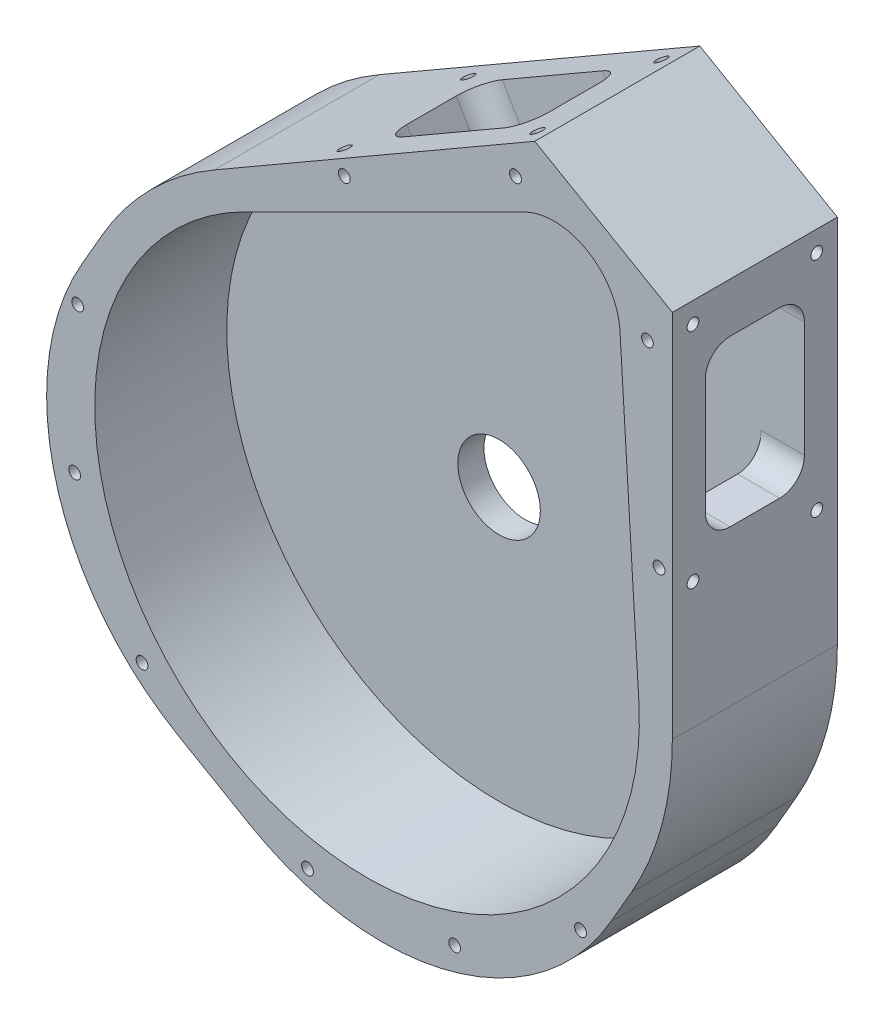
from build123d import *

# Parameters (mm, degrees)
BOSS_EXTRUDE1_DEPTH            = 31.75
CUT_EXTRUDE3_DEPTH             = 25.4
CUT_EXTRUDE4_REACH             = 168.724
F_4_40_TAPPED_HOLE1_AT_2_COUNT = 2
F_4_40_TAPPED_HOLE1_AT_2_PITCH = 23.8125
F_4_40_TAPPED_HOLE1_AT_3_COUNT = 2
F_4_40_TAPPED_HOLE1_AT_3_PITCH = 49.032938546
F_4_40_TAPPED_HOLE1_AT_4_COUNT = 2
F_4_40_TAPPED_HOLE1_AT_4_PITCH = 42.8625
F_4_40_TAPPED_HOLE3_AT_2_COUNT = 2
F_4_40_TAPPED_HOLE3_AT_2_PITCH = 105.48665894
F_4_40_TAPPED_HOLE3_AT_3_COUNT = 2
F_4_40_TAPPED_HOLE3_AT_3_PITCH = 124.969097047
F_4_40_TAPPED_HOLE3_AT_4_COUNT = 2
F_4_40_TAPPED_HOLE3_AT_4_PITCH = 36.810720416
F_4_40_TAPPED_HOLE3_AT_5_COUNT = 2
F_4_40_TAPPED_HOLE3_AT_5_PITCH = 137.285419975
SKETCH23_R                     = 7.9375
CUT_EXTRUDE6_DEPTH             = 123.151190591
SKETCH24_R                     = 10.0076
CUT_EXTRUDE9_DEPTH             = 1.3208
F_2_56_TAPPED_HOLE1_AT_2_COUNT = 2
F_2_56_TAPPED_HOLE1_AT_2_PITCH = 23.23749988
F_2_56_TAPPED_HOLE1_AT_3_COUNT = 2
F_2_56_TAPPED_HOLE1_AT_3_PITCH = 32.862787571
F_2_56_TAPPED_HOLE1_AT_4_COUNT = 2
F_2_56_TAPPED_HOLE1_AT_4_PITCH = 23.2375
LPATTERN1_COUNT                = 2
LPATTERN1_PITCH                = 71.501
F_4_40_TAPPED_HOLE5_AT_2_COUNT = 2
F_4_40_TAPPED_HOLE5_AT_2_PITCH = 12.7
F_4_40_TAPPED_HOLE5_AT_3_COUNT = 2
F_4_40_TAPPED_HOLE5_AT_3_PITCH = 95.193833559
FILLET3_R                      = 50.8


with BuildPart() as part:
    # Sketch1 (on Front Plane) → Boss-Extrude1 (new body)
    with BuildSketch(Plane.XY):
        with BuildLine():
            Line((58.7375, 0), (58.7375, 71.178534783))
            Line((58.7375, 71.178534783), (32.273669326, 86.457434546))
            Line((32.273669326, 86.457434546), (-29.36875, 50.868167155))
            ThreePointArc((-29.36875, 50.868167155), (-41.53368456, 41.53368456), (-50.868167155, 29.36875))
            Line((-50.868167155, 29.36875), (-80.236917155, -21.499417155))
            Line((-80.236917155, -21.499417155), (21.499417155, -80.236917155))
            Line((21.499417155, -80.236917155), (50.868167155, -29.36875))
            ThreePointArc((50.868167155, -29.36875), (56.736068222, -15.202383662), (58.7375, 0))
        make_face()
    extrude(amount=BOSS_EXTRUDE1_DEPTH)

    # Sketch4 → Cut-Extrude3 (cut)
    with BuildSketch(Plane.XY.offset(31.75)):
        with BuildLine():
            Line((30.568366553, 73.812917761), (-23.525977534, 46.807889691))
            ThreePointArc((-23.525977534, 46.807889691), (-26.19375, -45.368905841), (52.299810337, 3.029850652))
            Line((52.299810337, 3.029850652), (48.639678632, 63.379440867))
            ThreePointArc((48.639678632, 63.379440867), (42.332250779, 73.321609148), (30.568366553, 73.812917761))
        make_face()
    extrude(amount=-CUT_EXTRUDE3_DEPTH, mode=Mode.SUBTRACT)

    # Cut-Extrude4: up to this plane
    cut_extrude4_end = Plane(origin=(48.639678632, 63.379440867, -164.95869769), z_dir=(0.9981659181954072, 0.06053758958795559, 0))
    # Sketch5 → Cut-Extrude4 (cut, up to the surface)
    with BuildSketch(Plane(origin=(58.7375, 0, 0), x_dir=(0, 0, -1), z_dir=(1, 0, 0)), mode=Mode.PRIVATE) as cut_extrude4_sk1:
        with BuildLine():
            Line((-20.6375, 29.903534783), (-11.1125, 29.903534783))
            ThreePointArc((-11.1125, 29.903534783), (-7.744903955, 31.298438737), (-6.35, 34.666034783))
            Line((-6.35, 34.666034783), (-6.35, 56.891034783))
            ThreePointArc((-6.35, 56.891034783), (-7.744903955, 60.258630828), (-11.1125, 61.653534783))
            Line((-11.1125, 61.653534783), (-20.6375, 61.653534783))
            ThreePointArc((-20.6375, 61.653534783), (-24.005096045, 60.258630828), (-25.4, 56.891034783))
            Line((-25.4, 56.891034783), (-25.4, 34.666034783))
            ThreePointArc((-25.4, 34.666034783), (-24.005096045, 31.298438737), (-20.6375, 29.903534783))
        make_face()
    cut_extrude4_tool1 = split(extrude(cut_extrude4_sk1.sketch, amount=-CUT_EXTRUDE4_REACH, mode=Mode.PRIVATE), bisect_by=cut_extrude4_end, keep=Keep.BOTH, mode=Mode.PRIVATE)
    cut_extrude4 = cut_extrude4_tool1.solids().sort_by_distance((58.7375, 45.778535, 15.875))[0]
    add(cut_extrude4, mode=Mode.SUBTRACT)

    # Sketch11 → #4-40 Tapped Hole1 (revolve, cut)
    with BuildSketch(Plane(origin=(58.7375, 24.347284783, 27.78125), x_dir=(0, 0, -1), z_dir=(0, 1, 0))):
        Polygon((0, 0), (0, 5.759152758), (1.1303, 5.08), (1.1303, 0), align=None)
    f_4_40_tapped_hole1 = revolve(axis=Axis((65.0875, 24.347284783, 27.78125), (-1, 0, 0)), mode=Mode.SUBTRACT)

    # #4-40 Tapped Hole1 at 2: #4-40 Tapped Hole1 ×2
    with Locations(*[(0, 0, -i * F_4_40_TAPPED_HOLE1_AT_2_PITCH) for i in range(1, F_4_40_TAPPED_HOLE1_AT_2_COUNT)]):
        add(f_4_40_tapped_hole1, mode=Mode.SUBTRACT)

    # #4-40 Tapped Hole1 at 3: #4-40 Tapped Hole1 ×2
    with Locations(*[Vector(0, 0.8741572761215377, -0.4856429311786321) * (i * F_4_40_TAPPED_HOLE1_AT_3_PITCH) for i in range(1, F_4_40_TAPPED_HOLE1_AT_3_COUNT)]):
        add(f_4_40_tapped_hole1, mode=Mode.SUBTRACT)

    # #4-40 Tapped Hole1 at 4: #4-40 Tapped Hole1 ×2
    with Locations(*[(0, i * F_4_40_TAPPED_HOLE1_AT_4_PITCH, 0) for i in range(1, F_4_40_TAPPED_HOLE1_AT_4_COUNT)]):
        add(f_4_40_tapped_hole1, mode=Mode.SUBTRACT)

    # Mirror1: Cut-Extrude4, #4-40 Tapped Hole1 across plane
    add(cut_extrude4.mirror(Plane(origin=(45.505584663, 78.817984664, 31.75), x_dir=(0, 0, 1), z_dir=(-0.8660254037844403, 0.4999999999999974, 0))), mode=Mode.SUBTRACT)
    add(f_4_40_tapped_hole1.mirror(Plane(origin=(45.505584663, 78.817984664, 31.75), x_dir=(0, 0, 1), z_dir=(-0.8660254037844403, 0.4999999999999974, 0))), mode=Mode.SUBTRACT)

    # Mirror1 copy 1 sketch → Mirror1 copy 1 (revolve, cut)
    with BuildSketch(Plane(origin=(-8.283382865, 63.041809546, 3.96875), x_dir=(0, 0, -1), z_dir=(0.8660254037844357, 0.5000000000000052, 0))):
        Polygon((0, 0), (0, -5.759152758), (1.1303, -5.08), (1.1303, 0), align=None)
    revolve(axis=Axis((-11.458382865, 68.54107086, 3.96875), (-0.5000000000000056, 0.8660254037844357, 0)), mode=Mode.SUBTRACT)

    # Mirror1 copy 2 sketch → Mirror1 copy 2 (revolve, cut)
    with BuildSketch(Plane(origin=(28.836631005, 84.473059546, 3.96875), x_dir=(0, 0, -1), z_dir=(0.8660254037844357, 0.5000000000000052, 0))):
        Polygon((0, 0), (0, -5.759152758), (1.1303, -5.08), (1.1303, 0), align=None)
    revolve(axis=Axis((25.661631005, 89.97232086, 3.96875), (-0.5000000000000056, 0.8660254037844357, 0)), mode=Mode.SUBTRACT)

    # Mirror1 copy 3 sketch → Mirror1 copy 3 (revolve, cut)
    with BuildSketch(Plane(origin=(28.836631005, 84.473059546, 27.78125), x_dir=(0, 0, -1), z_dir=(0.8660254037844357, 0.5000000000000052, 0))):
        Polygon((0, 0), (0, -5.759152758), (1.1303, -5.08), (1.1303, 0), align=None)
    revolve(axis=Axis((25.661631005, 89.97232086, 27.78125), (-0.5000000000000056, 0.8660254037844357, 0)), mode=Mode.SUBTRACT)

    # Sketch21 → #4-40 Tapped Hole3 (revolve, cut)
    with BuildSketch(Plane(origin=(28.563997799, 78.776138947, 31.75), x_dir=(0, -1, 0), z_dir=(1, 0, 0))):
        Polygon((0, 0), (0, 9.569152758), (1.1303, 8.89), (1.1303, 0), align=None)
    f_4_40_tapped_hole3 = revolve(axis=Axis((28.563997799, 78.776138947, 38.1), (0, 0, -1)), mode=Mode.SUBTRACT)

    # #4-40 Tapped Hole3 at 2: #4-40 Tapped Hole3 ×2
    with Locations(*[Vector(-0.7985702472239283, -0.6019016200748376, 0) * (i * F_4_40_TAPPED_HOLE3_AT_2_PITCH) for i in range(1, F_4_40_TAPPED_HOLE3_AT_2_COUNT)]):
        add(f_4_40_tapped_hole3, mode=Mode.SUBTRACT)

    # #4-40 Tapped Hole3 at 3: #4-40 Tapped Hole3 ×2
    with Locations(*[Vector(-0.6786827972854597, -0.7344315221099812, 0) * (i * F_4_40_TAPPED_HOLE3_AT_3_PITCH) for i in range(1, F_4_40_TAPPED_HOLE3_AT_3_COUNT)]):
        add(f_4_40_tapped_hole3, mode=Mode.SUBTRACT)

    # #4-40 Tapped Hole3 at 4: #4-40 Tapped Hole3 ×2
    with Locations(*[Vector(-0.8948370136151804, -0.4463930096498663, 0) * (i * F_4_40_TAPPED_HOLE3_AT_4_PITCH) for i in range(1, F_4_40_TAPPED_HOLE3_AT_4_COUNT)]):
        add(f_4_40_tapped_hole3, mode=Mode.SUBTRACT)

    # #4-40 Tapped Hole3 at 5: #4-40 Tapped Hole3 ×2
    with Locations(*[Vector(-0.5233341450333103, -0.8521275565560911, 0) * (i * F_4_40_TAPPED_HOLE3_AT_5_PITCH) for i in range(1, F_4_40_TAPPED_HOLE3_AT_5_COUNT)]):
        add(f_4_40_tapped_hole3, mode=Mode.SUBTRACT)

    # Mirror2: #4-40 Tapped Hole3 across plane
    add(f_4_40_tapped_hole3.mirror(Plane(origin=(45.505584663, 78.817984664, 31.75), x_dir=(0, 0, 1), z_dir=(-0.8660254037844403, 0.4999999999999974, 0))), mode=Mode.SUBTRACT)

    # Mirror2 copy 1 sketch → Mirror2 copy 1 (revolve, cut)
    with BuildSketch(Plane(origin=(41.073195613, -40.573765561, 31.75), x_dir=(-0.8660254037844357, -0.5000000000000052, 0), z_dir=(-0.5000000000000056, 0.8660254037844357, 0))):
        Polygon((0, 0), (0, -9.569152758), (1.1303, -8.89), (1.1303, 0), align=None)
    revolve(axis=Axis((41.073195613, -40.573765561, 38.1), (0, 0, 1)), mode=Mode.SUBTRACT)

    # Mirror2 copy 2 sketch → Mirror2 copy 2 (revolve, cut)
    with BuildSketch(Plane(origin=(16.862437785, -55.216809411, 31.75), x_dir=(-0.8660254037844357, -0.5000000000000052, 0), z_dir=(-0.5000000000000056, 0.8660254037844357, 0))):
        Polygon((0, 0), (0, -9.569152758), (1.1303, -8.89), (1.1303, 0), align=None)
    revolve(axis=Axis((16.862437785, -55.216809411, 38.1), (0, 0, 1)), mode=Mode.SUBTRACT)

    # Mirror2 copy 3 sketch → Mirror2 copy 3 (revolve, cut)
    with BuildSketch(Plane(origin=(56.179364962, 27.382666896, 31.75), x_dir=(-0.8660254037844357, -0.5000000000000052, 0), z_dir=(-0.5000000000000056, 0.8660254037844357, 0))):
        Polygon((0, 0), (0, -9.569152758), (1.1303, -8.89), (1.1303, 0), align=None)
    revolve(axis=Axis((56.179364962, 27.382666896, 38.1), (0, 0, 1)), mode=Mode.SUBTRACT)

    # Mirror2 copy 4 sketch → Mirror2 copy 4 (revolve, cut)
    with BuildSketch(Plane(origin=(-11.448500353, -56.58771677, 31.75), x_dir=(-0.8660254037844357, -0.5000000000000052, 0), z_dir=(-0.5000000000000056, 0.8660254037844357, 0))):
        Polygon((0, 0), (0, -9.569152758), (1.1303, -8.89), (1.1303, 0), align=None)
    revolve(axis=Axis((-11.448500353, -56.58771677, 38.1), (0, 0, 1)), mode=Mode.SUBTRACT)

    # Sketch23 → Cut-Extrude6 (cut, through all)
    with BuildSketch(Plane(origin=(0, 0, 0), x_dir=(-1, 0, 0), z_dir=(0, 0, -1))):
        Circle(SKETCH23_R)
        with Locations((-35.818522025, 62.0395)):
            Circle(SKETCH23_R)
    extrude(amount=-CUT_EXTRUDE6_DEPTH, mode=Mode.SUBTRACT)

    # Sketch24 → Cut-Extrude9 (cut)
    with BuildSketch(Plane(origin=(0, 0, 0), x_dir=(-1, 0, 0), z_dir=(0, 0, -1))):
        Circle(SKETCH24_R)
        with Locations((-35.818522025, 62.0395)):
            Circle(SKETCH24_R)
    extrude(amount=-CUT_EXTRUDE9_DEPTH, mode=Mode.SUBTRACT)

    # Sketch26 → #4-40 Tapped Hole4 (revolve, cut)
    with BuildSketch(Plane(origin=(35.818522025, 46.0375, 6.35), x_dir=(0, -1, 0), z_dir=(1, 0, 0))):
        Polygon((0, 0), (0, 4.997152758), (1.1303, 4.318), (1.1303, 0), align=None)
    f_4_40_tapped_hole4 = revolve(axis=Axis((35.818522025, 46.0375, 12.7), (0, 0, -1)), mode=Mode.SUBTRACT)

    # Mirror3: #4-40 Tapped Hole4 across plane
    add(f_4_40_tapped_hole4.mirror(Plane(origin=(45.505584663, 78.817984664, 31.75), x_dir=(0, 0, 1), z_dir=(-0.8660254037844403, 0.4999999999999974, 0))), mode=Mode.SUBTRACT)

    # Sketch28 → #2-56 Tapped Hole1 (revolve, cut)
    with BuildSketch(Plane(origin=(51.690029634, 66.29225769, 0), x_dir=(0, 1, 0), z_dir=(1, 0, 0))):
        Polygon((0, 0), (0, 4.34416509), (0.889, 3.81), (0.889, 0), align=None)
    f_2_56_tapped_hole1 = revolve(axis=Axis((51.690029634, 66.29225769, -6.35), (0, 0, 1)), mode=Mode.SUBTRACT)

    # #2-56 Tapped Hole1 at 2: #2-56 Tapped Hole1 ×2
    with Locations(*[Vector(-0.8660254037844398, 0.4999999999999981, 0) * (i * F_2_56_TAPPED_HOLE1_AT_2_PITCH) for i in range(1, F_2_56_TAPPED_HOLE1_AT_2_COUNT)]):
        add(f_2_56_tapped_hole1, mode=Mode.SUBTRACT)

    # #2-56 Tapped Hole1 at 3: #2-56 Tapped Hole1 ×2
    with Locations(*[Vector(-0.9659258256207883, -0.25881904759657576, 0) * (i * F_2_56_TAPPED_HOLE1_AT_3_PITCH) for i in range(1, F_2_56_TAPPED_HOLE1_AT_3_COUNT)]):
        add(f_2_56_tapped_hole1, mode=Mode.SUBTRACT)

    # #2-56 Tapped Hole1 at 4: #2-56 Tapped Hole1 ×2
    with Locations(*[Vector(-0.49999999999999784, -0.8660254037844399, 0) * (i * F_2_56_TAPPED_HOLE1_AT_4_PITCH) for i in range(1, F_2_56_TAPPED_HOLE1_AT_4_COUNT)]):
        add(f_2_56_tapped_hole1, mode=Mode.SUBTRACT)

    # LPattern1: #2-56 Tapped Hole1 ×2
    with Locations(*[Vector(-0.49999999999999717, -0.8660254037844404, 0) * (i * LPATTERN1_PITCH) for i in range(1, LPATTERN1_COUNT)]):
        add(f_2_56_tapped_hole1, mode=Mode.SUBTRACT)

    # LPattern1 copy 1 sketch → LPattern1 copy 1 (revolve, cut)
    with BuildSketch(Plane(origin=(-4.184735583, 15.989325234, 0), x_dir=(0, 1, 0), z_dir=(1, 0, 0))):
        Polygon((0, 0), (0, 4.34416509), (0.889, 3.81), (0.889, 0), align=None)
    revolve(axis=Axis((-4.184735583, 15.989325234, -6.35), (0, 0, 1)), mode=Mode.SUBTRACT)

    # LPattern1 copy 2 sketch → LPattern1 copy 2 (revolve, cut)
    with BuildSketch(Plane(origin=(-15.803485583, -4.134940086, 0), x_dir=(0, 1, 0), z_dir=(1, 0, 0))):
        Polygon((0, 0), (0, 4.34416509), (0.889, 3.81), (0.889, 0), align=None)
    revolve(axis=Axis((-15.803485583, -4.134940086, -6.35), (0, 0, 1)), mode=Mode.SUBTRACT)

    # LPattern1 copy 3 sketch → LPattern1 copy 3 (revolve, cut)
    with BuildSketch(Plane(origin=(4.320779634, -15.753690026, 0), x_dir=(0, 1, 0), z_dir=(1, 0, 0))):
        Polygon((0, 0), (0, 4.34416509), (0.889, 3.81), (0.889, 0), align=None)
    revolve(axis=Axis((4.320779634, -15.753690026, -6.35), (0, 0, 1)), mode=Mode.SUBTRACT)

    # Sketch31 → #4-40 Tapped Hole5 (revolve, cut)
    with BuildSketch(Plane(origin=(-44.943536498, 33.280511314, 0), x_dir=(0, 1, 0), z_dir=(1, 0, 0))):
        Polygon((0, 0), (0, 9.569152758), (1.1303, 8.89), (1.1303, 0), align=None)
    f_4_40_tapped_hole5 = revolve(axis=Axis((-44.943536498, 33.280511314, -6.35), (0, 0, 1)), mode=Mode.SUBTRACT)

    # #4-40 Tapped Hole5 at 2: #4-40 Tapped Hole5 ×2
    with Locations(*[Vector(-0.49999999999999983, -0.8660254037844387, 0) * (i * F_4_40_TAPPED_HOLE5_AT_2_PITCH) for i in range(1, F_4_40_TAPPED_HOLE5_AT_2_COUNT)]):
        add(f_4_40_tapped_hole5, mode=Mode.SUBTRACT)

    # #4-40 Tapped Hole5 at 3: #4-40 Tapped Hole5 ×2
    with Locations(*[Vector(0.8757117633572225, 0.48283424435077527, 0) * (i * F_4_40_TAPPED_HOLE5_AT_3_PITCH) for i in range(1, F_4_40_TAPPED_HOLE5_AT_3_COUNT)]):
        add(f_4_40_tapped_hole5, mode=Mode.SUBTRACT)

    # Mirror4: #4-40 Tapped Hole5 across plane
    add(f_4_40_tapped_hole5.mirror(Plane(origin=(45.505584663, 78.817984664, 31.75), x_dir=(0, 0, 1), z_dir=(-0.8660254037844403, 0.4999999999999974, 0))), mode=Mode.SUBTRACT)

    # Mirror4 copy 1 sketch → Mirror4 copy 1 (revolve, cut)
    with BuildSketch(Plane(origin=(44.943536498, -33.280511314, 0), x_dir=(0.8660254037844357, 0.5000000000000052, 0), z_dir=(-0.5000000000000056, 0.8660254037844357, 0))):
        Polygon((0, 0), (0, -9.569152758), (1.1303, -8.89), (1.1303, 0), align=None)
    revolve(axis=Axis((44.943536498, -33.280511314, -6.35), (0, 0, -1)), mode=Mode.SUBTRACT)

    # Mirror4 copy 2 sketch → Mirror4 copy 2 (revolve, cut)
    with BuildSketch(Plane(origin=(49.417345977, 72.893354007, 0), x_dir=(0.8660254037844357, 0.5000000000000052, 0), z_dir=(-0.5000000000000056, 0.8660254037844357, 0))):
        Polygon((0, 0), (0, -9.569152758), (1.1303, -8.89), (1.1303, 0), align=None)
    revolve(axis=Axis((49.417345977, 72.893354007, -6.35), (0, 0, -1)), mode=Mode.SUBTRACT)

    # Fillet3
    fillet3_edges = [part.edges().sort_by_distance(p)[0] for p in [
        (21.499417155, -80.236917155, 15.875),
        (-80.236917155, -21.499417155, 15.875),
    ]]
    fillet(fillet3_edges, radius=FILLET3_R)


solid = part.part
